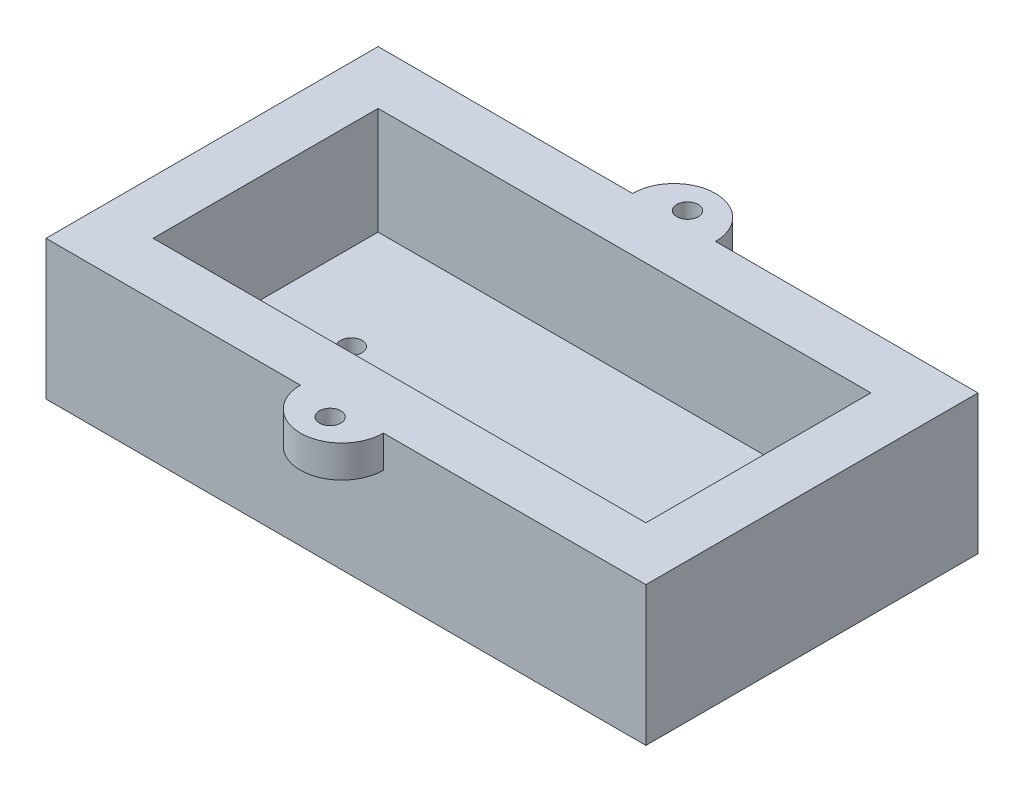
from build123d import *

# Parameters (mm, degrees)
SKETCH1_W           = 46
SKETCH1_H           = 21
BOSS_EXTRUDE4_DEPTH = 3
SKETCH1_5_W         = 56
SKETCH1_5_H         = 31
SKETCH1_5_W_2       = 46
SKETCH1_5_H_2       = 21
BOSS_EXTRUDE5_DEPTH = 13
BOSS_EXTRUDE6_DEPTH = 3
SKETCH5_R           = 1
CUT_EXTRUDE1_DEPTH  = 1.5
SKETCH6_R           = 1
CUT_EXTRUDE2_DEPTH  = 5


with BuildPart() as part:
    # Sketch1 → Boss-Extrude4 (new body)
    with BuildSketch(Plane(origin=(0, 0, 0), x_dir=(1, 0, 0), z_dir=(0, 1, 0))):
        with Locations((5.163934426, 4.663934426)):
            Rectangle(SKETCH1_W, SKETCH1_H)
    extrude(amount=BOSS_EXTRUDE4_DEPTH)

    # Sketch1<5> → Boss-Extrude5 (add)
    with BuildSketch(Plane(origin=(0, 0, 0), x_dir=(1, 0, 0), z_dir=(0, 1, 0))):
        with Locations((5.163934426, 4.663934426)):
            Rectangle(SKETCH1_5_W, SKETCH1_5_H)
        with Locations((5.163934426, 4.663934426)):
            Rectangle(SKETCH1_5_W_2, SKETCH1_5_H_2, mode=Mode.SUBTRACT)
    extrude(amount=BOSS_EXTRUDE5_DEPTH)

    # Sketch4 → Boss-Extrude6 (add)
    with BuildSketch(Plane(origin=(0, 13, 0), x_dir=(1, 0, 0), z_dir=(0, 1, 0))):
        with BuildLine():
            Line((0.913554246, 20.163934426), (8.664247516, 20.163934426))
            ThreePointArc((8.664247516, 20.163934426), (4.788900881, 24.039281061), (0.913554246, 20.163934426))
        make_face()
        with BuildLine():
            Line((0.913554246, -10.836065574), (8.664247516, -10.836065574))
            ThreePointArc((8.664247516, -10.836065574), (4.788900881, -14.711412209), (0.913554246, -10.836065574))
        make_face()
    extrude(amount=-BOSS_EXTRUDE6_DEPTH)

    # Sketch5 → Cut-Extrude1 (cut)
    with BuildSketch(Plane(origin=(0, 13, 0), x_dir=(1, 0, 0), z_dir=(0, 1, 0))):
        with Locations((4.869123842, 21.345488129)):
            Circle(SKETCH5_R)
        with Locations((4.869123842, -12.017619277)):
            Circle(SKETCH5_R)
    extrude(amount=-CUT_EXTRUDE1_DEPTH, mode=Mode.SUBTRACT)

    # Sketch6 → Cut-Extrude2 (cut)
    with BuildSketch(Plane(origin=(0, 3, 0), x_dir=(1, 0, 0), z_dir=(0, 1, 0))):
        with Locations((-9.836065574, 4.663934426)):
            Circle(SKETCH6_R)
        with Locations((20.163934426, 4.663934426)):
            Circle(SKETCH6_R)
    extrude(amount=-CUT_EXTRUDE2_DEPTH, mode=Mode.SUBTRACT)


solid = part.part
